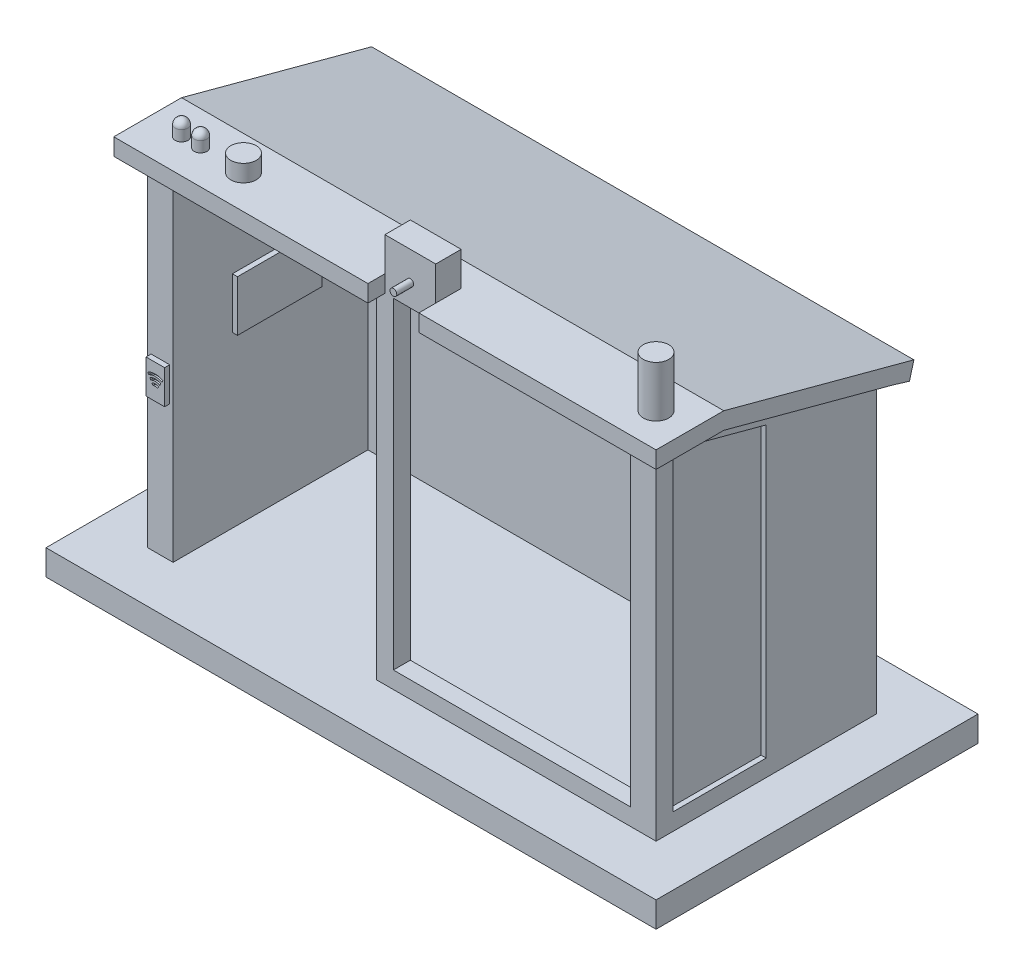
from build123d import *

# Parameters (mm, degrees)
SALIENTE_EXTRUIR11_DEPTH      = 200
CORTAR_EXTRUIR10_DEPTH        = 300
SALIENTE_EXTRUIR12_DEPTH      = 10
SALIENTE_EXTRUIR12_DEPTH_BACK = 310
CROQUIS30_W                   = 360
CROQUIS30_H                   = 190
SALIENTE_EXTRUIR13_DEPTH      = 15
CORTAR_EXTRUIR11_DEPTH        = 15
CROQUIS32_W                   = 5
CROQUIS32_H                   = 55
SALIENTE_EXTRUIR14_DEPTH      = 180
CROQUIS35_W                   = 11
CROQUIS35_H                   = 20
SALIENTE_EXTRUIR15_DEPTH      = 3
CORTAR_EXTRUIR12_DEPTH        = 1
CROQUIS40_W                   = 150
CROQUIS40_H                   = 10
SALIENTE_EXTRUIR16_DEPTH      = 10
CROQUIS41_W                   = 10
CROQUIS41_H                   = 10
SALIENTE_EXTRUIR17_DEPTH      = 190
CROQUIS42_W                   = 50
CROQUIS42_H                   = 30
SALIENTE_EXTRUIR18_DEPTH      = 3
CROQUIS43_W                   = 30
CROQUIS43_H                   = 10
CORTAR_EXTRUIR13_DEPTH        = 10
CROQUIS44_R                   = 7.5
SALIENTE_EXTRUIR19_DEPTH      = 30
CROQUIS45_W                   = 30
CROQUIS45_H                   = 15
SALIENTE_EXTRUIR20_DEPTH      = 20
CROQUIS47_R                   = 2
SALIENTE_EXTRUIR21_DEPTH      = 10
CORTAR_EXTRUIR14_START        = -10
CROQUIS49_R                   = 2
CORTAR_EXTRUIR14_DEPTH        = 10
CROQUIS50_R                   = 2
SALIENTE_EXTRUIR22_DEPTH      = 10
CROQUIS52_R                   = 3.75
SALIENTE_EXTRUIR29_DEPTH      = 10
REDONDEO6_R                   = 3.7
CROQUIS53_R                   = 7.5
SALIENTE_EXTRUIR30_DEPTH      = 10


with BuildPart() as part:
    # Croquis4 → Saliente-Extruir11 (new body)
    with BuildSketch(Plane(origin=(0, 0, 0), x_dir=(1, 0, 0), z_dir=(0, 1, 0))):
        Polygon((-150, 65), (150, 65), (150, -65), (135, -65), (135, 50), (-135, 50), (-135, -65), (-150, -65), align=None)
    extrude(amount=SALIENTE_EXTRUIR11_DEPTH)

    # Croquis28 → Cortar-Extruir10 (cut)
    with BuildSketch(Plane.ZY.offset(150)):
        Polygon((-65, 173.205080757), (35, 200), (-65, 200), align=None)
    extrude(amount=-CORTAR_EXTRUIR10_DEPTH, mode=Mode.SUBTRACT)

    # Croquis29 → Saliente-Extruir12 (add, two sides: drawn at the far end of the back side and taken through both)
    with BuildSketch(Plane.ZY.offset(150).offset(-SALIENTE_EXTRUIR12_DEPTH_BACK)):
        Polygon((-65, 173.205080757), (35, 200), (65, 200), (75, 200), (75, 210), (35, 210), (-67.5, 182.535207776), (-77.159258263, 179.947017325), (-74.571067812, 170.287759062), align=None)
    extrude(amount=SALIENTE_EXTRUIR12_DEPTH + SALIENTE_EXTRUIR12_DEPTH_BACK)

    # Croquis30 → Saliente-Extruir13 (add)
    with BuildSketch(Plane.XZ):
        Rectangle(CROQUIS30_W, CROQUIS30_H)
    extrude(amount=SALIENTE_EXTRUIR13_DEPTH)

    # Croquis31 → Cortar-Extruir11 (cut)
    with BuildSketch(Plane(origin=(150, 0, 0), x_dir=(0, 0, -1), z_dir=(1, 0, 0))):
        Polygon((-55, 190), (-55, 10), (0, 10), (0, 180.269016461), (-36.316524976, 190), align=None)
    extrude(amount=-CORTAR_EXTRUIR11_DEPTH, mode=Mode.SUBTRACT)

    # Croquis32 → Saliente-Extruir14 (add)
    with BuildSketch(Plane(origin=(0, 10, 0), x_dir=(1, 0, 0), z_dir=(0, 1, 0))):
        with Locations((144.5, -27.5)):
            Rectangle(CROQUIS32_W, CROQUIS32_H)
    extrude(amount=SALIENTE_EXTRUIR14_DEPTH)

    # Croquis35 → Saliente-Extruir15 (add)
    with BuildSketch(Plane.XY.offset(65)):
        with Locations((-142.5, 90)):
            Rectangle(CROQUIS35_W, CROQUIS35_H)
    extrude(amount=SALIENTE_EXTRUIR15_DEPTH)

    # Croquis36 → Cortar-Extruir12 (cut)
    with BuildSketch(Plane.XY.offset(68)):
        with BuildLine():
            Line((-143.875, 87.38156986), (-144.5, 88.464101615))
            ThreePointArc((-144.5, 88.464101615), (-142.5, 89), (-140.5, 88.464101615))
            Line((-140.5, 88.464101615), (-141.125, 87.38156986))
            ThreePointArc((-141.125, 87.38156986), (-142.5, 87.75), (-143.875, 87.38156986))
        make_face()
        with BuildLine():
            Line((-139.875, 89.54663337), (-139.25, 90.629165125))
            ThreePointArc((-139.25, 90.629165125), (-142.5, 91.5), (-145.75, 90.629165125))
            Line((-145.75, 90.629165125), (-145.125, 89.54663337))
            ThreePointArc((-145.125, 89.54663337), (-142.5, 90.25), (-139.875, 89.54663337))
        make_face()
        with BuildLine():
            Line((-146.375, 91.711696879), (-147, 92.794228634))
            ThreePointArc((-147, 92.794228634), (-142.5, 94), (-138, 92.794228634))
            Line((-138, 92.794228634), (-138.625, 91.711696879))
            ThreePointArc((-138.625, 91.711696879), (-142.5, 92.75), (-146.375, 91.711696879))
        make_face()
    extrude(amount=-CORTAR_EXTRUIR12_DEPTH, mode=Mode.SUBTRACT)

    # Croquis40 → Saliente-Extruir16 (add)
    with BuildSketch(Plane(origin=(0, 0, 0), x_dir=(1, 0, 0), z_dir=(0, 1, 0))):
        with Locations((60, -60)):
            Rectangle(CROQUIS40_W, CROQUIS40_H)
    extrude(amount=SALIENTE_EXTRUIR16_DEPTH)

    # Croquis41 → Saliente-Extruir17 (add)
    with BuildSketch(Plane(origin=(0, 10, 0), x_dir=(1, 0, 0), z_dir=(0, 1, 0))):
        with Locations((-10, -60)):
            Rectangle(CROQUIS41_W, CROQUIS41_H)
    extrude(amount=SALIENTE_EXTRUIR17_DEPTH)

    # Croquis42 → Saliente-Extruir18 (add)
    with BuildSketch(Plane(origin=(-135, 0, 0), x_dir=(0, 0, -1), z_dir=(1, 0, 0))):
        with Locations((-5, 115)):
            Rectangle(CROQUIS42_W, CROQUIS42_H)
    extrude(amount=SALIENTE_EXTRUIR18_DEPTH)

    # Croquis43 → Cortar-Extruir13 (cut)
    with BuildSketch(Plane(origin=(0, 210, 0), x_dir=(1, 0, 0), z_dir=(0, 1, 0))):
        with Locations((5, -70)):
            Rectangle(CROQUIS43_W, CROQUIS43_H)
    extrude(amount=-CORTAR_EXTRUIR13_DEPTH, mode=Mode.SUBTRACT)

    # Croquis44 → Saliente-Extruir19 (add)
    with BuildSketch(Plane(origin=(0, 210, 0), x_dir=(1, 0, 0), z_dir=(0, 1, 0))):
        with Locations(Location((140, -55, 0), (0, 0, 90))):
            Circle(CROQUIS44_R)
    extrude(amount=SALIENTE_EXTRUIR19_DEPTH)

    # Croquis45 → Saliente-Extruir20 (add)
    with BuildSketch(Plane(origin=(0, 210, 0), x_dir=(1, 0, 0), z_dir=(0, 1, 0))):
        with Locations((5, -57.5)):
            Rectangle(CROQUIS45_W, CROQUIS45_H)
    extrude(amount=SALIENTE_EXTRUIR20_DEPTH)

    # Croquis47 → Saliente-Extruir21 (add)
    with BuildSketch(Plane.XY.offset(65)):
        with Locations(Location((5, 215, 0), (0, 0, 180))):
            Circle(CROQUIS47_R)
    extrude(amount=SALIENTE_EXTRUIR21_DEPTH)

    # Croquis49 → Cortar-Extruir14 (cut)
    with BuildSketch(Plane.XY.offset(75).offset(CORTAR_EXTRUIR14_START)):
        with Locations((5, 215)):
            Circle(CROQUIS49_R)
    extrude(amount=CORTAR_EXTRUIR14_DEPTH, mode=Mode.SUBTRACT)

    # Croquis50 → Saliente-Extruir22 (add)
    with BuildSketch(Plane.XY.offset(65)):
        with Locations(Location((5, 213, 0), (0, 0, 180))):
            Circle(CROQUIS50_R)
    extrude(amount=SALIENTE_EXTRUIR22_DEPTH)

    # Croquis52 → Saliente-Extruir29 (add)
    with BuildSketch(Plane(origin=(0, 210, 0), x_dir=(1, 0, 0), z_dir=(0, 1, 0))):
        with Locations(Location((-140, -55, 0), (0, 0, 90))):
            Circle(CROQUIS52_R)
        with Locations(Location((-128.75988107, -55, 0), (0, 0, 90))):
            Circle(CROQUIS52_R)
    extrude(amount=SALIENTE_EXTRUIR29_DEPTH)

    # Redondeo6
    redondeo6_edges = [part.edges().sort_by_distance(p)[0] for p in [
        (-140, 220, 58.75),
        (-128.75988107, 220, 58.75),
    ]]
    fillet(redondeo6_edges, radius=REDONDEO6_R)

    # Croquis53 → Saliente-Extruir30 (add)
    with BuildSketch(Plane(origin=(0, 210, 0), x_dir=(1, 0, 0), z_dir=(0, 1, 0))):
        with Locations(Location((-103.450024464, -55, 0), (0, 0, 90))):
            Circle(CROQUIS53_R)
    extrude(amount=SALIENTE_EXTRUIR30_DEPTH)


solid = part.part
